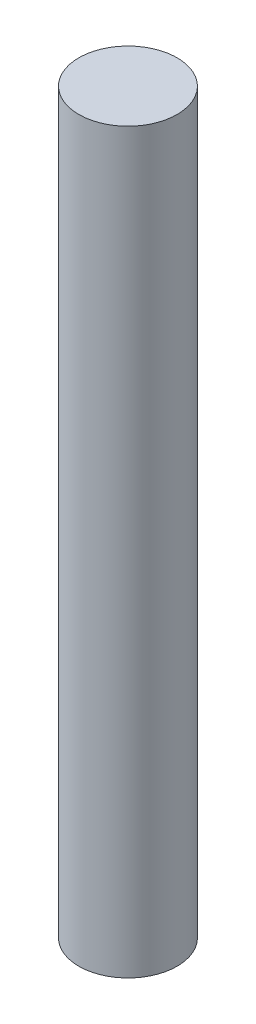
from build123d import *

# Parameters (mm, degrees)
BOSS_EXTRUDE1_DEPTH      = 65.055556997
BOSS_EXTRUDE1_DEPTH_BACK = 10
SKETCH1_R                = 5


with BuildPart() as part:
    # Sketch1 → Boss-Extrude1 (new, two sides: drawn at the far end of the back side and taken through both)
    with BuildSketch(Plane(origin=(0, 0, 0), x_dir=(1, 0, 0), z_dir=(0, 1, 0)).offset(-BOSS_EXTRUDE1_DEPTH_BACK)):
        with Locations(Location((0, 0, 0), (0, 0, 270))):
            Circle(SKETCH1_R)
    extrude(amount=BOSS_EXTRUDE1_DEPTH + BOSS_EXTRUDE1_DEPTH_BACK)


solid = part.part
